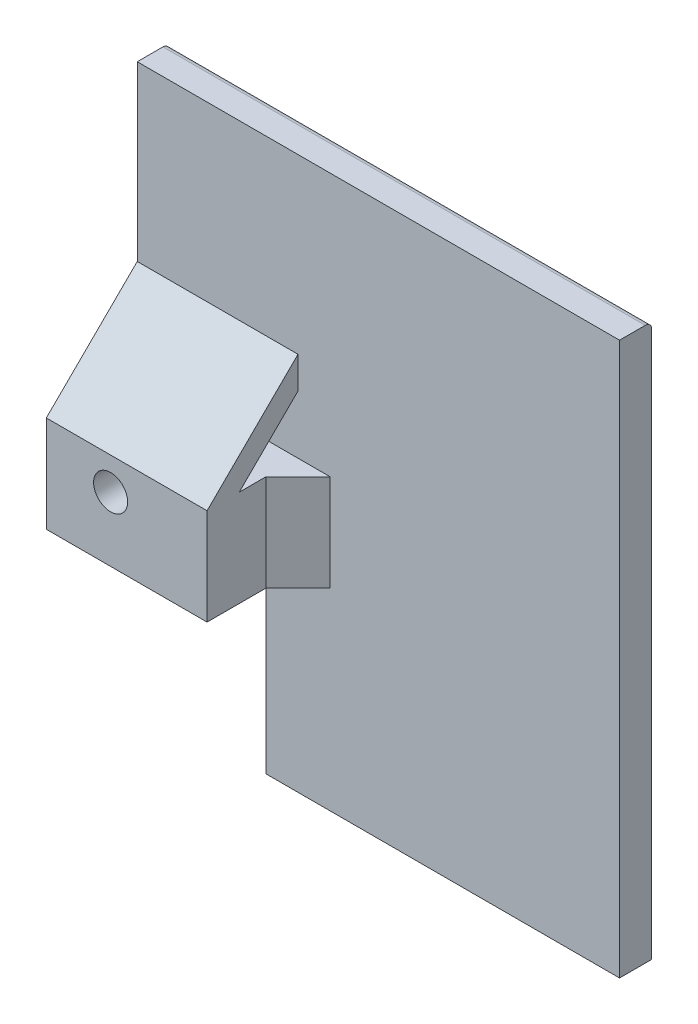
from build123d import *

# Parameters (mm, degrees)
SKETCH1_W           = 20
SKETCH1_H           = 15
SKETCH1_R           = 2.65
SKETCH1_W_2         = 5
BOSS_EXTRUDE1_DEPTH = 5
SKETCH2_W           = 5
SKETCH2_H           = 15
BOSS_EXTRUDE2_DEPTH = 14.142135624
SKETCH3_W           = 5
SKETCH3_H           = 15
BOSS_EXTRUDE3_DEPTH = 50
SKETCH4_W           = 55
SKETCH4_H           = 5
BOSS_EXTRUDE4_DEPTH = 40.9
SKETCH5_W           = 20
SKETCH5_H           = 26.9
BOSS_EXTRUDE5_DEPTH = 5
BOSS_EXTRUDE6_REACH = 96.603
CHAMFER1_SIZE       = 5
FILLET5_R           = 1
SKETCH7_W           = 55
SKETCH7_H           = 5
BOSS_EXTRUDE7_DEPTH = 30


with BuildPart() as part:
    # Sketch1 → Boss-Extrude1 (new body)
    # profile 1 of 2: a face of its own
    with BuildSketch(Plane.XY):
        with Locations((10, 7.5)):
            Rectangle(SKETCH1_W, SKETCH1_H)
        with Locations((10, 10)):
            Circle(SKETCH1_R, mode=Mode.SUBTRACT)
    # profile 2 of 2: a face of its own
    with BuildSketch(Plane.XY):
        with Locations((22.5, 7.5)):
            Rectangle(SKETCH1_W_2, SKETCH1_H)
    extrude(amount=BOSS_EXTRUDE1_DEPTH)

    # Sketch2 → Boss-Extrude2 (add)
    with BuildSketch(Plane(origin=(0, 0, 0), x_dir=(-1, 0, 0), z_dir=(0, 0, -1))):
        with Locations((-22.5, 7.5)):
            Rectangle(SKETCH2_W, SKETCH2_H)
    extrude(amount=BOSS_EXTRUDE2_DEPTH)

    # Sketch3 → Boss-Extrude3 (add)
    with BuildSketch(Plane(origin=(25, 0, 0), x_dir=(0, 0, -1), z_dir=(1, 0, 0))):
        with Locations((11.642135624, 7.5)):
            Rectangle(SKETCH3_W, SKETCH3_H)
    extrude(amount=BOSS_EXTRUDE3_DEPTH)

    # Sketch4 → Boss-Extrude4 (add)
    with BuildSketch(Plane(origin=(0, 15, 0), x_dir=(1, 0, 0), z_dir=(0, 1, 0))):
        with Locations((47.5, 11.642135624)):
            Rectangle(SKETCH4_W, SKETCH4_H)
    extrude(amount=BOSS_EXTRUDE4_DEPTH)

    # Sketch5 → Boss-Extrude5 (add)
    with BuildSketch(Plane(origin=(0, 0, -14.142135624), x_dir=(-1, 0, 0), z_dir=(0, 0, -1))):
        with Locations((-10, 42.45)):
            Rectangle(SKETCH5_W, SKETCH5_H)
    extrude(amount=-BOSS_EXTRUDE5_DEPTH)

    # Boss-Extrude6: up to this face of the body (flat: up to its plane)
    boss_extrude6_end = Plane(part.part.faces().sort_by_distance((25, 7.5, -2.071067812))[0])
    # Sketch6 → Boss-Extrude6 (add, up to the picked face)
    with BuildSketch(Plane.ZY, mode=Mode.PRIVATE) as boss_extrude6_sk1:
        Polygon((0, 15), (-14.142135624, 29), (-9.142135624, 29), (5, 15), align=None)
    boss_extrude6_tool1 = split(extrude(boss_extrude6_sk1.sketch, amount=-BOSS_EXTRUDE6_REACH, mode=Mode.PRIVATE), bisect_by=boss_extrude6_end, keep=Keep.BOTH, mode=Mode.PRIVATE)
    add(boss_extrude6_tool1.solids().sort_by(Axis((0, 22, -4.571068), (1, 0, 0)))[0])

    # Chamfer1
    chamfer1_edges = [part.edges().sort_by_distance(p)[0] for p in [
        (25, 7.5, -9.142135624),
    ]]
    chamfer(chamfer1_edges, length=CHAMFER1_SIZE)

    # Fillet5
    fillet5_edges = [part.edges().sort_by_distance(p)[0] for p in [
        (37.5, 55.9, -14.142135624),
    ]]
    fillet(fillet5_edges, radius=FILLET5_R)

    # Sketch7 → Boss-Extrude7 (add)
    with BuildSketch(Plane.XZ):
        with Locations((47.5, -11.642135624)):
            Rectangle(SKETCH7_W, SKETCH7_H)
    extrude(amount=BOSS_EXTRUDE7_DEPTH)


solid = part.part
